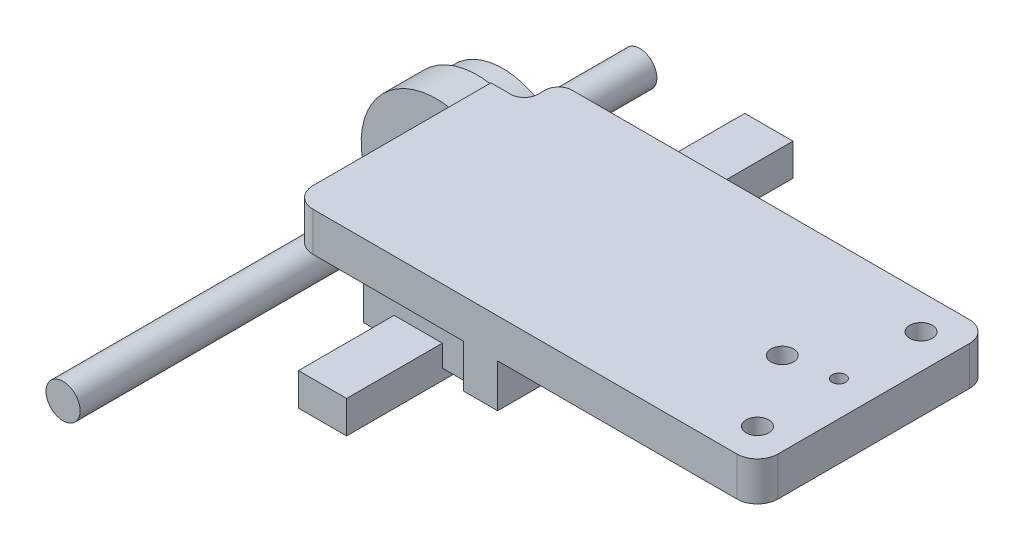
from build123d import *

# Parameters (mm, degrees)
BOSS_EXTRUDE1_DEPTH             = 7.2517
FILLET1_R                       = 2.54
SKETCH3_W                       = 6.3246
SKETCH3_H                       = 43.2054
BOSS_EXTRUDE2_DEPTH             = 8.0264
SKETCH4_W                       = 20.32
SKETCH4_H                       = 39.7256
BOSS_EXTRUDE3_DEPTH             = 8.0264
SKETCH5_W                       = 8.9535
SKETCH5_H                       = 39.7256
BOSS_EXTRUDE4_DEPTH             = 2.032
BOSS_EXTRUDE5_DEPTH             = 7.62
SKETCH7_R                       = 12.6365
BOSS_EXTRUDE6_DEPTH             = 4.7625
SKETCH8_R                       = 6.35
BOSS_EXTRUDE7_DEPTH             = 12.7
SKETCH10_R                      = 3.175
BOSS_EXTRUDE8_DEPTH             = 56.642
BOSS_EXTRUDE9_START             = 25.4
SKETCH12_R                      = 3.175
BOSS_EXTRUDE9_DEPTH             = 25.4
SKETCH15_W                      = 8.9535
SKETCH15_H                      = 6.039178017
BOSS_EXTRUDE12_DEPTH            = 17.78
SKETCH14_W                      = 8.9535
SKETCH14_H                      = 5.969
BOSS_EXTRUDE13_DEPTH            = 25.4
TAP_DRILL_FOR_M5X0_8_TAP1_D     = 4.2
TAP_DRILL_FOR_M5X0_8_TAP1_DEPTH = 25.4
TAP_DRILL_FOR_M5X0_8_TAP1_TIP   = 1.2618073
TAP_DRILL_FOR_M3X0_5_TAP1_D     = 2.5
TAP_DRILL_FOR_M3X0_5_TAP1_DEPTH = 25.4
TAP_DRILL_FOR_M3X0_5_TAP1_TIP   = 0.751075774
TAP_DRILL_FOR_M5X0_8_TAP2_D     = 4.2
TAP_DRILL_FOR_M5X0_8_TAP2_DEPTH = 25.4
TAP_DRILL_FOR_M5X0_8_TAP2_TIP   = 1.2618073


with BuildPart() as part:
    # Sketch1 → Boss-Extrude1 (new body)
    with BuildSketch(Plane(origin=(0, 0, 0), x_dir=(1, 0, 0), z_dir=(0, 1, 0))):
        with BuildLine():
            Line((39.37, 21.6027), (-36.9824, 21.6027))
            Line((-36.9824, 21.6027), (-36.9824, 15.2527))
            Line((-36.9824, 15.2527), (-36.9824, -21.6027))
            Line((-36.9824, -21.6027), (39.37, -21.6027))
            ThreePointArc((39.37, -21.6027), (42.064076836, -20.486776836), (43.18, -17.7927))
            Line((43.18, -17.7927), (43.18, 17.7927))
            ThreePointArc((43.18, 17.7927), (42.064076836, 20.486776836), (39.37, 21.6027))
        make_face()
        with BuildLine():
            Line((-36.9824, -21.6027), (-36.9824, 15.2527))
            Line((-36.9824, 15.2527), (-43.18, 15.2527))
            Line((-43.18, 15.2527), (-43.18, -17.7927))
            ThreePointArc((-43.18, -17.7927), (-42.064076836, -20.486776836), (-39.37, -21.6027))
            Line((-39.37, -21.6027), (-36.9824, -21.6027))
        make_face()
    extrude(amount=BOSS_EXTRUDE1_DEPTH)

    # Fillet1
    fillet1_edges = [part.edges().sort_by_distance(p)[0] for p in [
        (-36.9824, 3.62585, -15.2527),
        (-36.9824, 3.62585, -21.6027),
    ]]
    fillet(fillet1_edges, radius=FILLET1_R)

    # Sketch3 → Boss-Extrude2 (add)
    with BuildSketch(Plane.XZ):
        with Locations((-8.2423, 0)):
            Rectangle(SKETCH3_W, SKETCH3_H)
    extrude(amount=BOSS_EXTRUDE2_DEPTH)

    # Sketch4 → Boss-Extrude3 (add)
    with BuildSketch(Plane.XZ):
        with Locations((-21.5646, 0)):
            Rectangle(SKETCH4_W, SKETCH4_H)
    extrude(amount=BOSS_EXTRUDE3_DEPTH)

    # Sketch5 → Boss-Extrude4 (add)
    with BuildSketch(Plane.XZ.offset(8.0264)):
        with Locations((-21.5646, 0)):
            Rectangle(SKETCH5_W, SKETCH5_H)
    extrude(amount=BOSS_EXTRUDE4_DEPTH)

    # Sketch6 → Boss-Extrude5 (add)
    with BuildSketch(Plane(origin=(0, 0, -15.2527), x_dir=(-1, 0, 0), z_dir=(0, 0, -1))):
        with BuildLine():
            Line((31.7246, 0), (31.7246, -6.7183))
            ThreePointArc((31.7246, -6.7183), (59.227378961, -10.185978415), (33.44611662, 0))
            Line((33.44611662, 0), (31.7246, 0))
        make_face()
    extrude(amount=-BOSS_EXTRUDE5_DEPTH)

    # Sketch7 → Boss-Extrude6 (add)
    with BuildSketch(Plane(origin=(0, 0, -15.2527), x_dir=(-1, 0, 0), z_dir=(0, 0, -1))):
        with Locations((45.6946, -6.7183)):
            Circle(SKETCH7_R)
    extrude(amount=BOSS_EXTRUDE6_DEPTH)

    # Sketch8 → Boss-Extrude7 (add)
    with BuildSketch(Plane.XY.offset(-7.6327)):
        with Locations(Location((-45.6946, -6.7183, 0), (0, 0, 180))):
            Circle(SKETCH8_R)
    extrude(amount=BOSS_EXTRUDE7_DEPTH)

    # Sketch10 → Boss-Extrude8 (add)
    with BuildSketch(Plane.XY.offset(5.0673)):
        with Locations((-45.6946, -6.7183)):
            Circle(SKETCH10_R)
    extrude(amount=BOSS_EXTRUDE8_DEPTH)

    # Sketch12 → Boss-Extrude9 (add)
    with BuildSketch(Plane(origin=(0, 0, -20.0152), x_dir=(-1, 0, 0), z_dir=(0, 0, -1)).offset(BOSS_EXTRUDE9_START)):
        with Locations(Location((45.6946, -6.7183, 0), (0, 0, 180))):
            Circle(SKETCH12_R)
    extrude(amount=-BOSS_EXTRUDE9_DEPTH)

    # Sketch15 → Boss-Extrude12 (add)
    with BuildSketch(Plane.XY.offset(19.8628)):
        with Locations((-21.5646, -7.038810992)):
            Rectangle(SKETCH15_W, SKETCH15_H)
    extrude(amount=BOSS_EXTRUDE12_DEPTH)

    # Sketch14 → Boss-Extrude13 (add)
    with BuildSketch(Plane(origin=(0, 0, -19.8628), x_dir=(-1, 0, 0), z_dir=(0, 0, -1))):
        with Locations((21.5646, -7.0739)):
            Rectangle(SKETCH14_W, SKETCH14_H)
    extrude(amount=BOSS_EXTRUDE13_DEPTH)

    # Tap Drill for M5x0.8 Tap1
    with Locations(Plane(origin=(0, 7.2517, 0), x_dir=(1, 0, 0), z_dir=(0, 1, 0))):
        with Locations((36.8046, 15.1511), (36.83, -15.2527)):
            Hole(TAP_DRILL_FOR_M5X0_8_TAP1_D / 2, depth=TAP_DRILL_FOR_M5X0_8_TAP1_DEPTH)
            with Locations((0, 0, -(TAP_DRILL_FOR_M5X0_8_TAP1_DEPTH + TAP_DRILL_FOR_M5X0_8_TAP1_TIP / 2))):  # 118° drill point
                Cone(0, TAP_DRILL_FOR_M5X0_8_TAP1_D / 2, TAP_DRILL_FOR_M5X0_8_TAP1_TIP, mode=Mode.SUBTRACT)

    # Tap Drill for M3x0.5 Tap1
    with Locations(Plane(origin=(0, 7.2517, 0), x_dir=(1, 0, 0), z_dir=(0, 1, 0))):
        with Locations((36.703, 0)):
            Hole(TAP_DRILL_FOR_M3X0_5_TAP1_D / 2, depth=TAP_DRILL_FOR_M3X0_5_TAP1_DEPTH)
            with Locations((0, 0, -(TAP_DRILL_FOR_M3X0_5_TAP1_DEPTH + TAP_DRILL_FOR_M3X0_5_TAP1_TIP / 2))):  # 118° drill point
                Cone(0, TAP_DRILL_FOR_M3X0_5_TAP1_D / 2, TAP_DRILL_FOR_M3X0_5_TAP1_TIP, mode=Mode.SUBTRACT)

    # Tap Drill for M5x0.8 Tap2
    with Locations(Plane(origin=(0, 7.2517, 0), x_dir=(1, 0, 0), z_dir=(0, 1, 0))):
        with Locations((27.7241, -1.5367)):
            Hole(TAP_DRILL_FOR_M5X0_8_TAP2_D / 2, depth=TAP_DRILL_FOR_M5X0_8_TAP2_DEPTH)
            with Locations((0, 0, -(TAP_DRILL_FOR_M5X0_8_TAP2_DEPTH + TAP_DRILL_FOR_M5X0_8_TAP2_TIP / 2))):  # 118° drill point
                Cone(0, TAP_DRILL_FOR_M5X0_8_TAP2_D / 2, TAP_DRILL_FOR_M5X0_8_TAP2_TIP, mode=Mode.SUBTRACT)


solid = part.part
